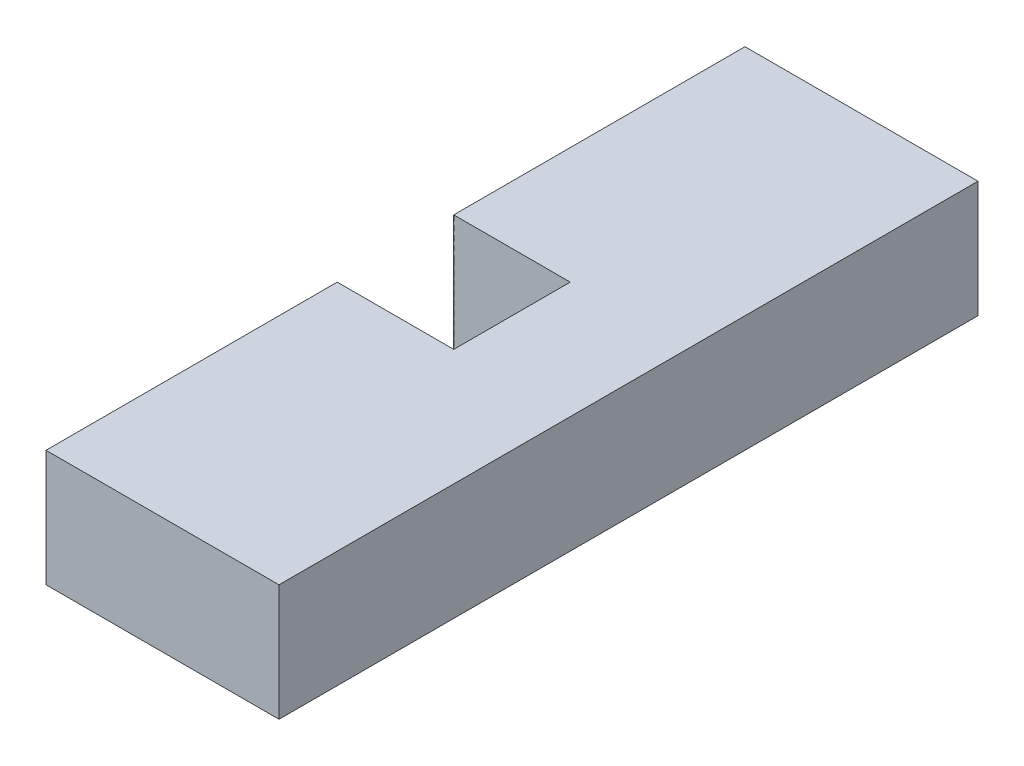
from build123d import *

# Parameters (mm, degrees)
SKETCH1_W           = 12.7
SKETCH1_H           = 38.1
BOSS_EXTRUDE1_DEPTH = 6.35
SKETCH2_W           = 12.7
SKETCH2_H           = 6.35
CUT_EXTRUDE1_DEPTH  = 22.060567419


with BuildPart() as part:
    # Sketch1 → Boss-Extrude1 (new body)
    with BuildSketch(Plane(origin=(0, 0, 0), x_dir=(1, 0, 0), z_dir=(0, 1, 0))):
        Rectangle(SKETCH1_W, SKETCH1_H)
    extrude(amount=BOSS_EXTRUDE1_DEPTH)

    # Sketch2 → Cut-Extrude1 (cut, through all)
    with BuildSketch(Plane(origin=(0, 6.35, 0), x_dir=(1, 0, 0), z_dir=(0, 1, 0))):
        with Locations((-6.35, 0)):
            Rectangle(SKETCH2_W, SKETCH2_H)
    extrude(amount=-CUT_EXTRUDE1_DEPTH, mode=Mode.SUBTRACT)


solid = part.part
